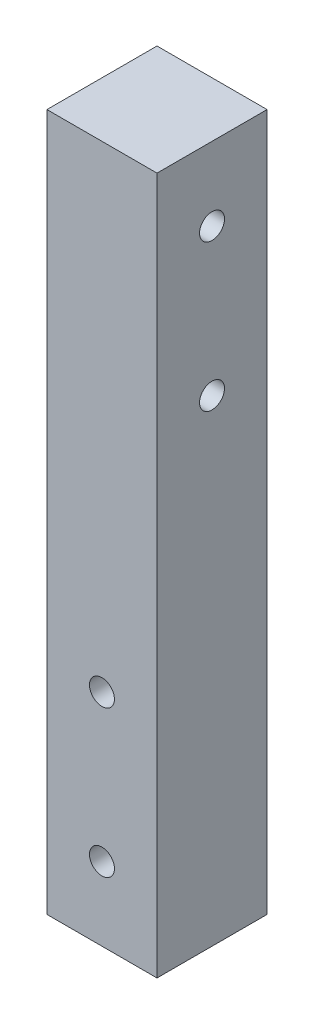
from build123d import *

# Parameters (mm, degrees)
SKETCH_1_W          = 15
SKETCH_1_H          = 15
EXTRUDE_1_DEPTH     = 95
SKETCH_2_R          = 1.7
CUT_EXTRUDE_1_DEPTH = 98.33961167
SKETCH_3_R          = 1.7
CUT_EXTRUDE_2_DEPTH = 98.33961167


with BuildPart() as part:
    # 草图1 → 凸台-拉伸1 (new body)
    with BuildSketch(Plane(origin=(0, 0, 0), x_dir=(1, 0, 0), z_dir=(0, 1, 0))):
        with Locations((7.5, 7.5)):
            Rectangle(SKETCH_1_W, SKETCH_1_H)
    extrude(amount=EXTRUDE_1_DEPTH)

    # 草图2 → 切除-拉伸1 (cut, through all)
    with BuildSketch(Plane.XY):
        with Locations((7.5, 10)):
            Circle(SKETCH_2_R)
        with Locations((7.5, 30)):
            Circle(SKETCH_2_R)
    extrude(amount=-CUT_EXTRUDE_1_DEPTH, mode=Mode.SUBTRACT)

    # 草图3 → 切除-拉伸2 (cut, through all)
    with BuildSketch(Plane(origin=(15, 0, 0), x_dir=(0, 0, -1), z_dir=(1, 0, 0))):
        with Locations((7.5, 85)):
            Circle(SKETCH_3_R)
        with Locations((7.5, 65)):
            Circle(SKETCH_3_R)
    extrude(amount=-CUT_EXTRUDE_2_DEPTH, mode=Mode.SUBTRACT)


solid = part.part
